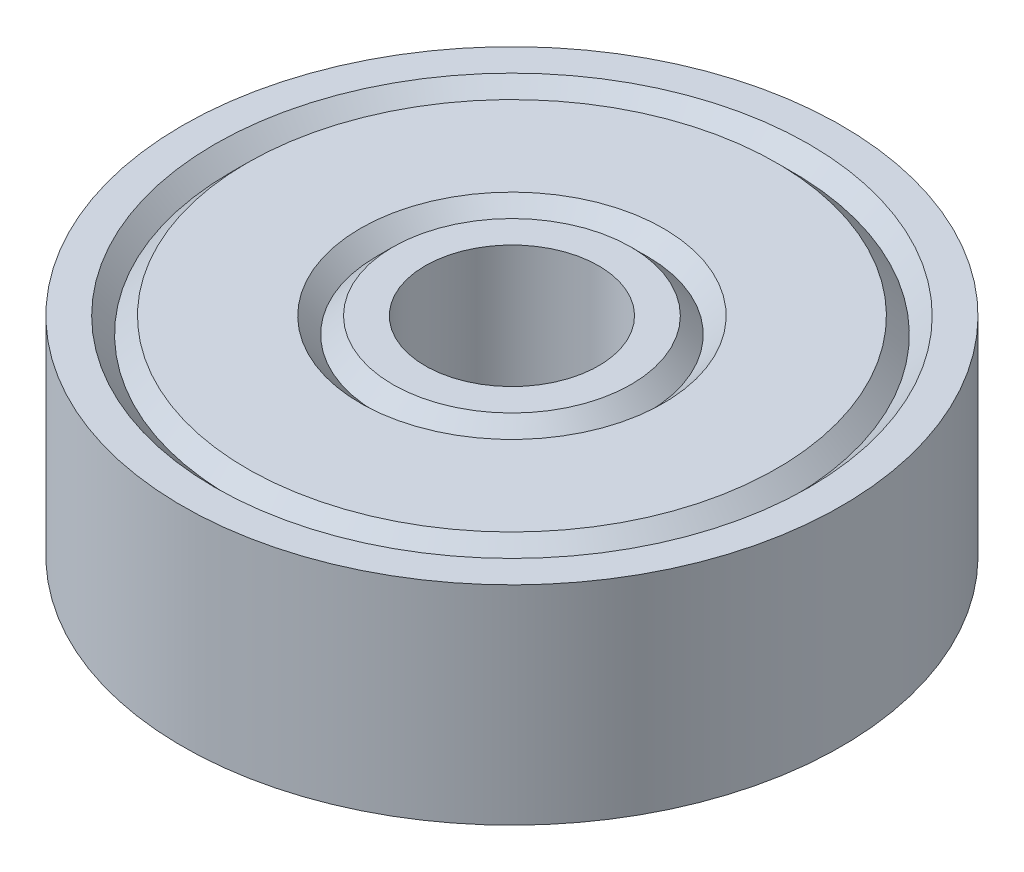
from build123d import *


with BuildPart() as part:
    # Sketch1 → Revolve1 (revolve)
    with BuildSketch(Plane.XY):
        Polygon((-2.5, 3), (-3.433333333, 3), (-3.9, 2.533333333), (-4.366666667, 3), (-7.633333333, 3), (-8.1, 2.533333333), (-8.566666667, 3), (-9.5, 3), (-9.5, -3), (-8.566666667, -3), (-8.1, -2.533333333), (-7.633333333, -3), (-4.366666667, -3), (-3.9, -2.533333333), (-3.433333333, -3), (-2.5, -3), align=None)
    revolve(axis=Axis((0, 3, 0), (0, -1, 0)))


solid = part.part
